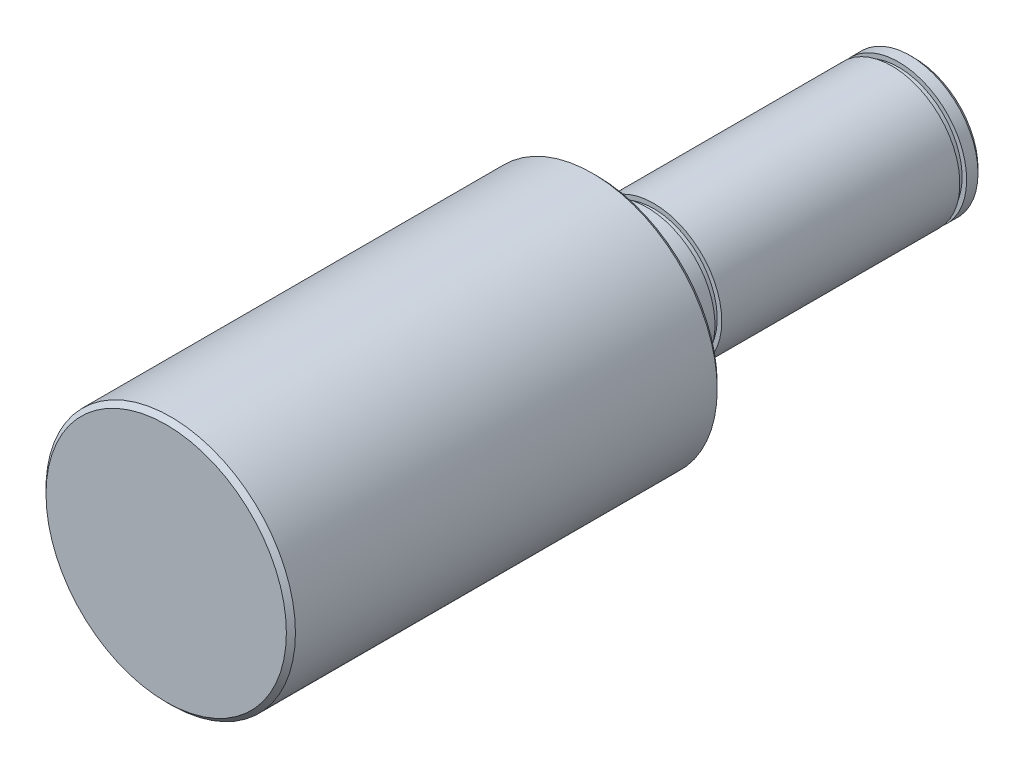
from build123d import *

# Parameters (mm, degrees)
SKETCH_1_R      = 15
EXTRUDE_1_DEPTH = 70
SKETCH_2_R      = 27.5
EXTRUDE_2_DEPTH = 95
CHAMFER_1_SIZE  = 1
SKETCH_3_W      = 5.21377611
SKETCH_3_H      = 1.5


with BuildPart() as part:
    # 草图1 → 凸台-拉伸1 (new body)
    with BuildSketch(Plane.XY):
        Circle(SKETCH_1_R)
    extrude(amount=EXTRUDE_1_DEPTH)

    # 草图2 → 凸台-拉伸2 (add)
    with BuildSketch(Plane.XY.offset(70)):
        Circle(SKETCH_2_R)
    extrude(amount=EXTRUDE_2_DEPTH)

    # 倒角1
    chamfer_1_edges = [part.edges().sort_by_distance(p)[0] for p in [
        (-15, 0, 0),
        (-27.5, 0, 70),
        (-27.5, 0, 165),
    ]]
    chamfer(chamfer_1_edges, length=CHAMFER_1_SIZE)

    # 草图3 → 切除-旋转1 (revolve, cut)
    with BuildSketch(Plane(origin=(0, 0, 0), x_dir=(1, 0, 0), z_dir=(0, 1, 0)), mode=Mode.PRIVATE) as cut_revolve_1_sk:
        with Locations((16.606888055, -58.25)):
            Rectangle(SKETCH_3_W, SKETCH_3_H)
        with Locations((16.606888055, -4.25)):
            Rectangle(SKETCH_3_W, SKETCH_3_H)
    revolve(cut_revolve_1_sk.sketch.rotate(Axis((0, 0, -18.215048165), (0, 0, 1)), 180), axis=Axis((0, 0, -18.215048165), (0, 0, 1)), mode=Mode.SUBTRACT)


solid = part.part
